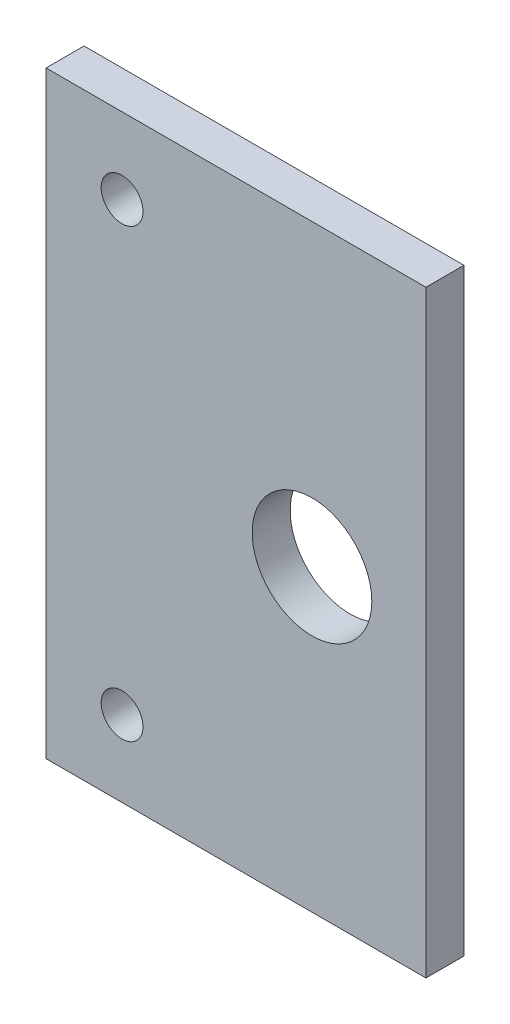
from build123d import *

# Parameters (mm, degrees)
SKETCH1_W           = 63.5
SKETCH1_H           = 100
SKETCH1_R           = 3.5
SKETCH1_R_2         = 10
BOSS_EXTRUDE1_DEPTH = 6.35


with BuildPart() as part:
    # Sketch1 → Boss-Extrude1 (new body)
    with BuildSketch(Plane.XY):
        with Locations((0, 50)):
            Rectangle(SKETCH1_W, SKETCH1_H)
        with Locations((-19.05, 12.7)):
            Circle(SKETCH1_R, mode=Mode.SUBTRACT)
        with Locations(Location((-19.05, 87.3, 0), (0, 0, 180))):
            Circle(SKETCH1_R, mode=Mode.SUBTRACT)
        with Locations((12.7, 50)):
            Circle(SKETCH1_R_2, mode=Mode.SUBTRACT)
    extrude(amount=BOSS_EXTRUDE1_DEPTH)


solid = part.part
